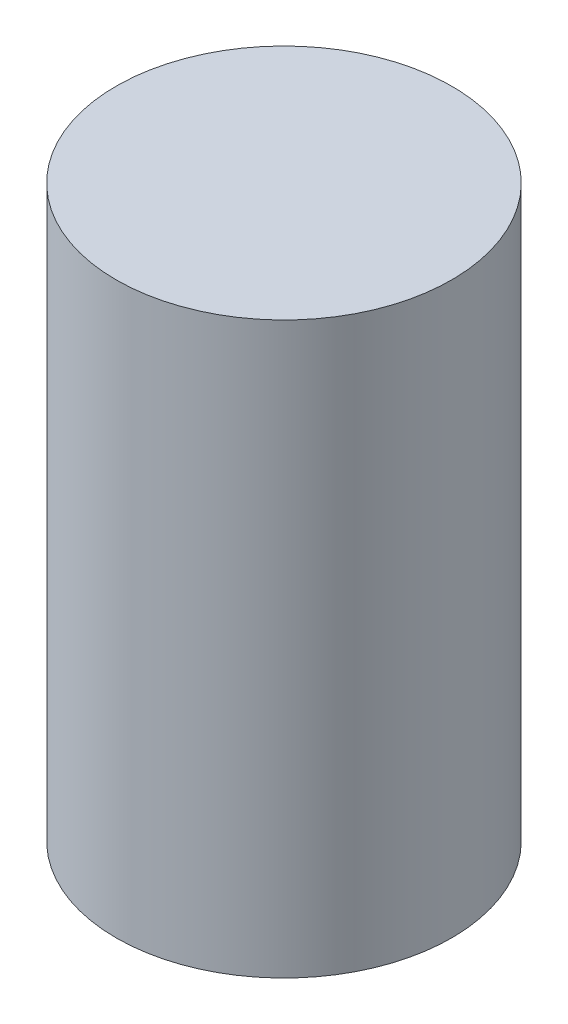
from build123d import *

# Parameters (mm, degrees)
ESQUISSE1_R        = 73.61
BOSS_EXTRU_1_DEPTH = 250


with BuildPart() as part:
    # Esquisse1 → Boss.-Extru.1 (new body)
    with BuildSketch(Plane(origin=(0, 0, 0), x_dir=(1, 0, 0), z_dir=(0, 1, 0))):
        with Locations(Location((0, 0, 0), (0, 0, 270))):
            Circle(ESQUISSE1_R)
    extrude(amount=BOSS_EXTRU_1_DEPTH)


solid = part.part
